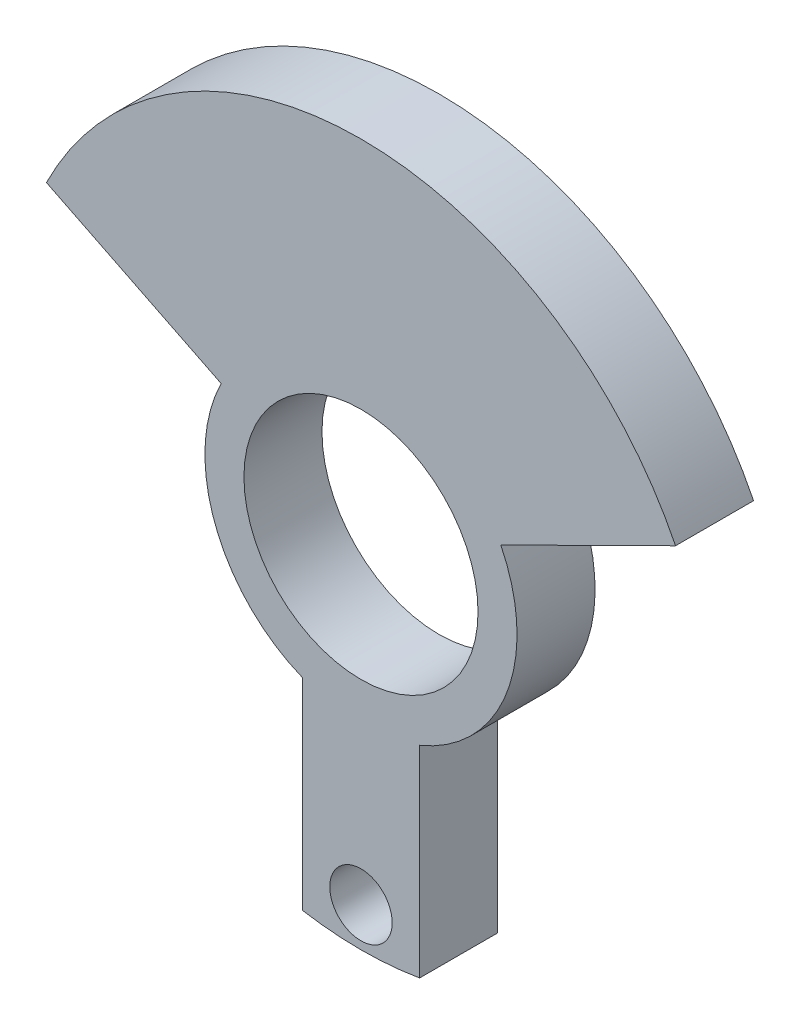
from build123d import *

# Parameters (mm, degrees)
SKETCH1_R           = 15
BOSS_EXTRUDE1_DEPTH = 5
SKETCH2_R           = 4
CUT_EXTRUDE1_DEPTH  = 62.23724357


with BuildPart() as part:
    # Sketch1 → Boss-Extrude1 (new, symmetric)
    with BuildSketch(Plane.XY):
        with BuildLine():
            Line((-40.311288741, 20), (-17.91612833, 8.888888889))
            ThreePointArc((-17.91612833, 8.888888889), (-18.699713239, -7.093710227), (-7.512794536, -18.535315435))
            Line((-7.512794536, -18.535315435), (-7.512794536, -44.368433804))
            ThreePointArc((-7.512794536, -44.368433804), (0, -45), (7.512794536, -44.368433804))
            Line((7.512794536, -44.368433804), (7.512794536, -18.535315435))
            ThreePointArc((7.512794536, -18.535315435), (18.699713239, -7.093710227), (17.91612833, 8.888888889))
            Line((17.91612833, 8.888888889), (40.311288741, 20))
            ThreePointArc((40.311288741, 20), (0, 45), (-40.311288741, 20))
        make_face()
        Circle(SKETCH1_R, mode=Mode.SUBTRACT)
    extrude(amount=BOSS_EXTRUDE1_DEPTH, both=True)

    # Sketch2 → Cut-Extrude1 (cut, through all)
    with BuildSketch(Plane.XY.offset(5)):
        with Locations((0, -40)):
            Circle(SKETCH2_R)
    extrude(amount=-CUT_EXTRUDE1_DEPTH, mode=Mode.SUBTRACT)


solid = part.part
